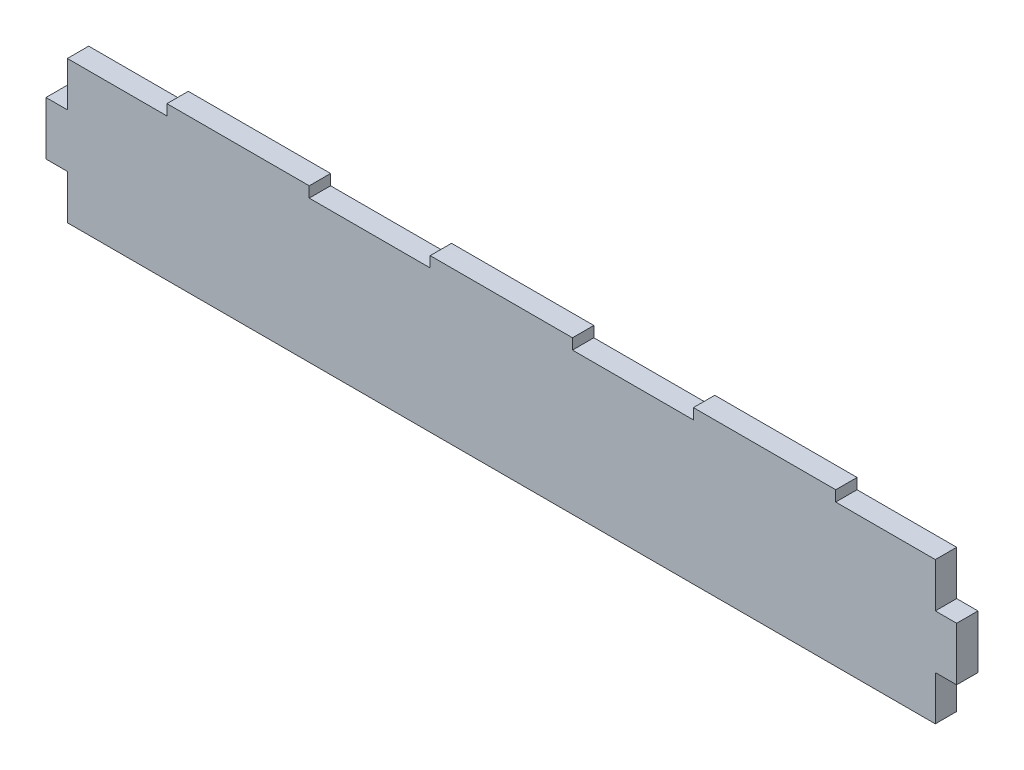
from build123d import *

# Parameters (mm, degrees)
EXTRUDE_1_DEPTH = 6


with BuildPart() as part:
    # Эскиз2 → Бобышка-Вытянуть1 (new body)
    with BuildSketch(Plane.XY):
        Polygon((68, 40), (102, 40), (102, 43), (142, 43), (142, 40), (176, 40), (176, 43), (216, 43), (216, 40), (244, 40), (244, 27.5), (250, 27.5), (250, 12.5), (244, 12.5), (244, 0), (0, 0), (0, 12.5), (-6, 12.5), (-6, 27.5), (0, 27.5), (0, 40), (28, 40), (28, 43), (68, 43), align=None)
    extrude(amount=EXTRUDE_1_DEPTH)


solid = part.part
